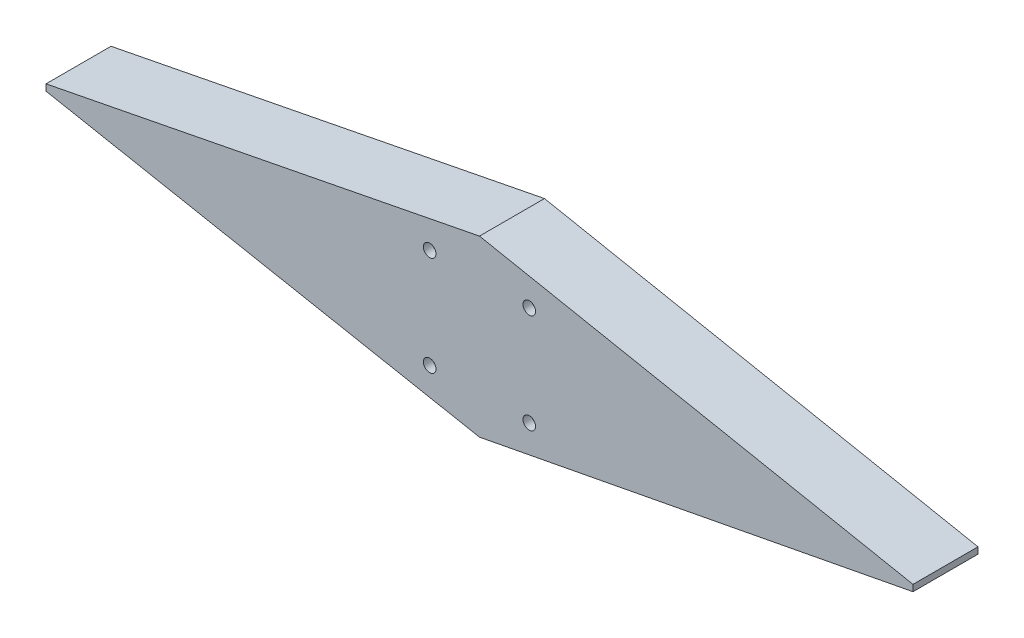
from build123d import *

# Parameters (mm, degrees)
SKETCH1_W              = 200
SKETCH1_H              = 50
BOSS_EXTRUDE1_DEPTH    = 7.5
CUT_EXTRUDE1_DEPTH     = 105.16333328
SHELL2_T               = -2
F_20_0MM_DOWEL_HOLE1_D = 2.9


with BuildPart() as part:
    # Sketch1 → Boss-Extrude1 (new, symmetric)
    with BuildSketch(Plane.XY):
        Rectangle(SKETCH1_W, SKETCH1_H)
    extrude(amount=BOSS_EXTRUDE1_DEPTH, both=True)

    # Sketch15 → Cut-Extrude1 (cut, through all)
    with BuildSketch(Plane(origin=(0, 0, -7.5), x_dir=(-1, 0, 0), z_dir=(0, 0, -1))):
        Polygon((-100.000000026, 0.510192391), (-100, 25), (100, 25), (100.000000026, 0.510192391), (0, 20.08555215), align=None)
        Polygon((-100.000000029, -0.965448702), (-100, -25), (100, -25), (100, -0.965448702), (0, -20.08535521), align=None)
    extrude(amount=-CUT_EXTRUDE1_DEPTH, mode=Mode.SUBTRACT)

    # Shell2
    shell2_openings = [part.faces().sort_by_distance(p)[0] for p in [
        (4e-09, -0.078500046, -7.5),
    ]]
    offset(amount=SHELL2_T, openings=shell2_openings)

    # Ø20.0mm Dowel Hole1 (through all)
    with Locations(Plane.XY.offset(7.5)):
        with Locations((-11.490485194, 11.490485194), (11.490485194, -11.490485194), (11.490485194, 11.490485194), (-11.490485194, -11.490485194)):
            Hole(F_20_0MM_DOWEL_HOLE1_D / 2)


solid = part.part
